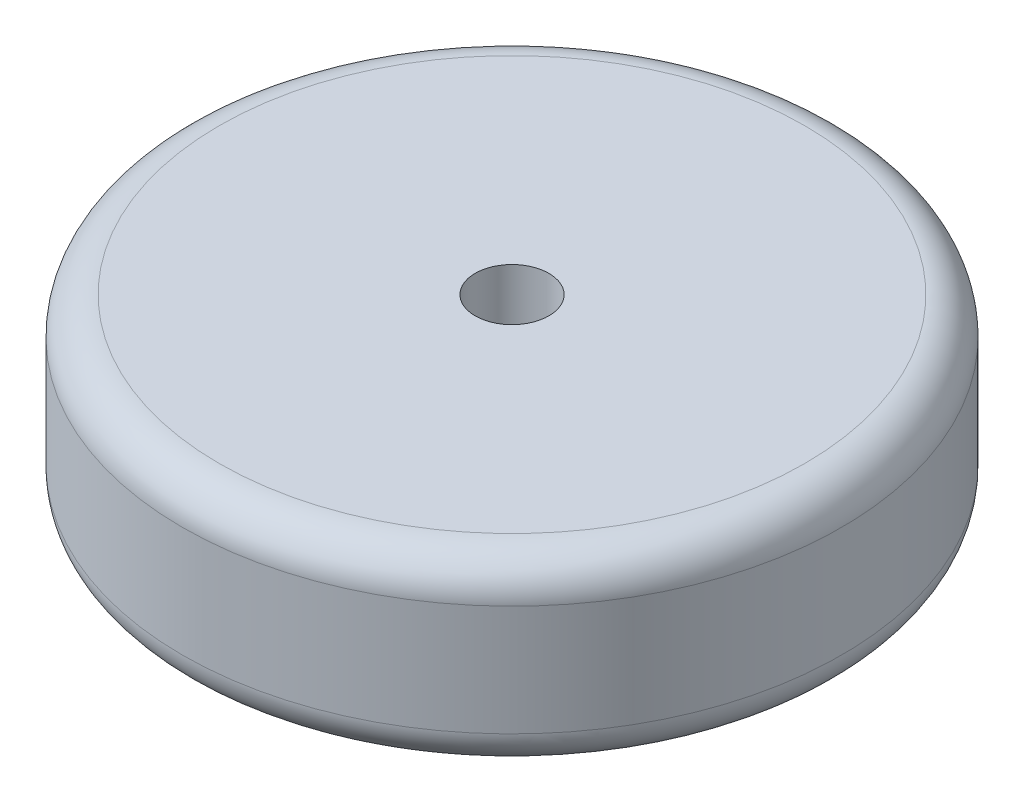
from build123d import *

# Parameters (mm, degrees)
SKETCH1_R           = 8.94
BOSS_EXTRUDE1_DEPTH = 5
FILLET1_R           = 1
CUT_EXTRUDE1_REACH  = 15.596
SKETCH2_R           = 1


with BuildPart() as part:
    # Sketch1 → Boss-Extrude1 (new body)
    with BuildSketch(Plane(origin=(0, 0, 0), x_dir=(1, 0, 0), z_dir=(0, 1, 0))):
        with Locations(Location((0, 0, 0), (0, 0, 270))):
            Circle(SKETCH1_R)
    extrude(amount=BOSS_EXTRUDE1_DEPTH)

    # Fillet1
    fillet1_edges = [part.edges().sort_by_distance(p)[0] for p in [
        (0, 0, -8.94),
        (0, 5, -8.94),
    ]]
    fillet(fillet1_edges, radius=FILLET1_R)

    # Sketch2 → Cut-Extrude1 (cut, up to next)
    with BuildSketch(Plane(origin=(0, 5, 0), x_dir=(1, 0, 0), z_dir=(0, 1, 0)), mode=Mode.PRIVATE) as cut_extrude1_sk1:
        with Locations(Location((0, 0, 0), (0, 0, 270))):
            Circle(SKETCH2_R)
    cut_extrude1_tool1 = extrude(cut_extrude1_sk1.sketch, amount=-CUT_EXTRUDE1_REACH, mode=Mode.PRIVATE) & part.part
    add(cut_extrude1_tool1.solids().sort_by_distance((0, 5, 0))[0], mode=Mode.SUBTRACT)


solid = part.part
